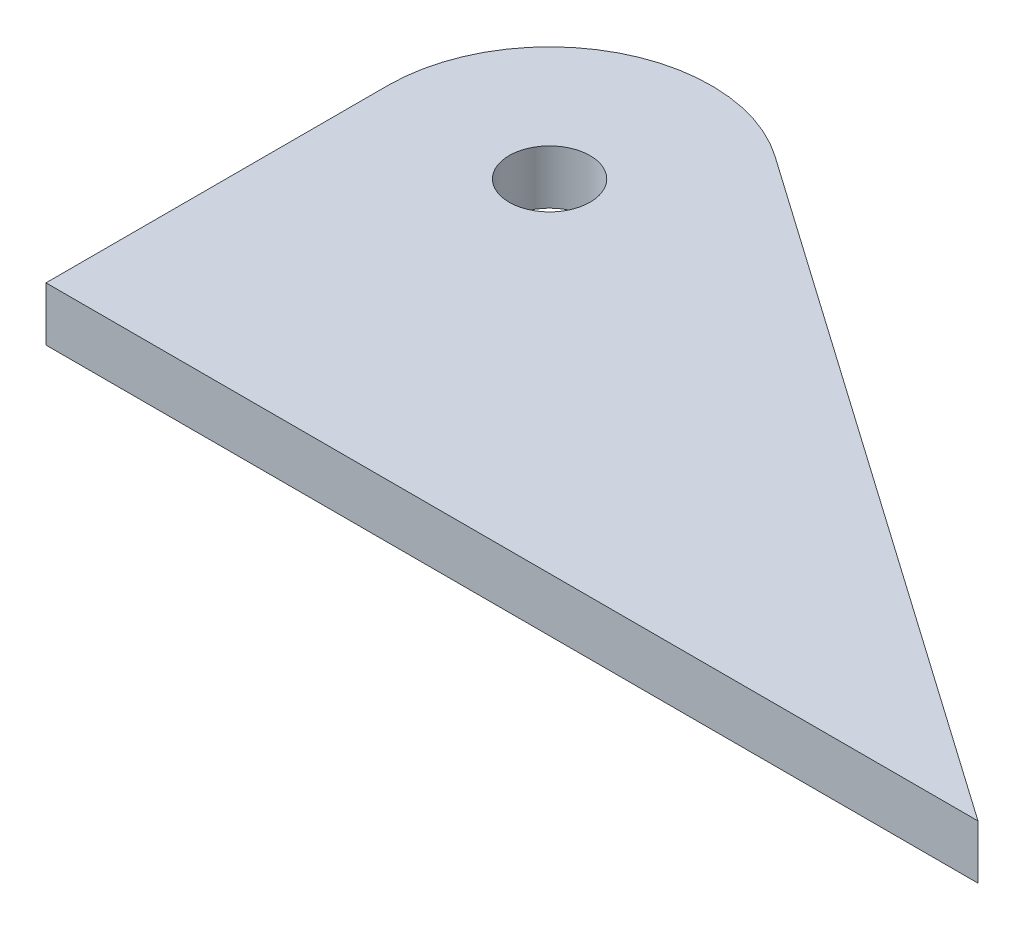
from build123d import *

# Parameters (mm, degrees)
BOSS_EXTRUDE2_DEPTH = 6.35


with BuildPart() as part:
    # Sketch1 → Boss-Extrude2 (new body)
    # profile 1 of 5: a face of its own
    with BuildSketch(Plane(origin=(0, 0, 0), x_dir=(1, 0, 0), z_dir=(0, 1, 0))):
        with BuildLine():
            Line((19.05, 45.006744084), (19.05, 59.294244084))
            ThreePointArc((19.05, 59.294244084), (5.579615818, 53.714628266), (0, 40.244244084))
            Line((0, 40.244244084), (0, 0))
            Line((0, 0), (19.05, 0))
            Line((19.05, 0), (19.05, 8.89))
            Line((19.05, 8.89), (8.89, 8.89))
            Line((8.89, 8.89), (8.89, 24.129750608))
            ThreePointArc((8.89, 24.129750608), (13.762212217, 21.942828828), (19.05, 21.194244084))
            Line((19.05, 21.194244084), (19.05, 35.481744084))
            ThreePointArc((19.05, 35.481744084), (14.2875, 40.244244084), (19.05, 45.006744084))
        make_face()
    # profile 2 of 5: a face of its own
    with BuildSketch(Plane(origin=(0, 0, 0), x_dir=(1, 0, 0), z_dir=(0, 1, 0))):
        with BuildLine():
            ThreePointArc((29.976631112, 55.849090528), (24.778445481, 58.412551996), (19.05, 59.294244084))
            Line((19.05, 59.294244084), (19.05, 45.006744084))
            ThreePointArc((19.05, 45.006744084), (22.417596045, 43.611840129), (23.8125, 40.244244084))
            ThreePointArc((23.8125, 40.244244084), (22.417596045, 36.876648039), (19.05, 35.481744084))
            Line((19.05, 35.481744084), (19.05, 21.194244084))
            ThreePointArc((19.05, 21.194244084), (22.242798897, 21.463708011), (25.345272951, 22.264476608))
            Line((25.345272951, 22.264476608), (34.29, 8.89))
            Line((34.29, 8.89), (19.05, 8.89))
            Line((19.05, 8.89), (19.05, 0))
            Line((19.05, 0), (109.737398428, 0))
            Line((109.737398428, 0), (29.976631112, 55.849090528))
        make_face()
        with BuildLine():
            Line((46.99, 8.89), (33.57249636, 27.915432321))
            ThreePointArc((33.57249636, 27.915432321), (35.515172131, 30.66298077), (36.94411395, 33.709476611))
            Line((36.94411395, 33.709476611), (72.39, 8.89))
            Line((72.39, 8.89), (46.99, 8.89))
        make_face(mode=Mode.SUBTRACT)
    # profile 3 of 5: a face of its own
    with BuildSketch(Plane(origin=(0, 0, 0), x_dir=(1, 0, 0), z_dir=(0, 1, 0))):
        with BuildLine():
            ThreePointArc((25.345272951, 22.264476608), (22.242798897, 21.463708011), (19.05, 21.194244084))
            Line((19.05, 21.194244084), (19.05, 8.89))
            Line((19.05, 8.89), (34.29, 8.89))
            Line((34.29, 8.89), (25.345272951, 22.264476608))
        make_face()
    # profile 4 of 5: a face of its own
    with BuildSketch(Plane(origin=(0, 0, 0), x_dir=(1, 0, 0), z_dir=(0, 1, 0))):
        with BuildLine():
            Line((19.05, 8.89), (19.05, 21.194244084))
            ThreePointArc((19.05, 21.194244084), (13.762212217, 21.942828828), (8.89, 24.129750608))
            Line((8.89, 24.129750608), (8.89, 8.89))
            Line((8.89, 8.89), (19.05, 8.89))
        make_face()
    # profile 5 of 5: a face of its own
    with BuildSketch(Plane(origin=(0, 0, 0), x_dir=(1, 0, 0), z_dir=(0, 1, 0))):
        with BuildLine():
            ThreePointArc((33.57249636, 27.915432321), (35.515172131, 30.66298077), (36.94411395, 33.709476611))
            Line((36.94411395, 33.709476611), (72.39, 8.89))
            Line((72.39, 8.89), (46.99, 8.89))
            Line((46.99, 8.89), (33.57249636, 27.915432321))
        make_face()
    extrude(amount=BOSS_EXTRUDE2_DEPTH)


solid = part.part
